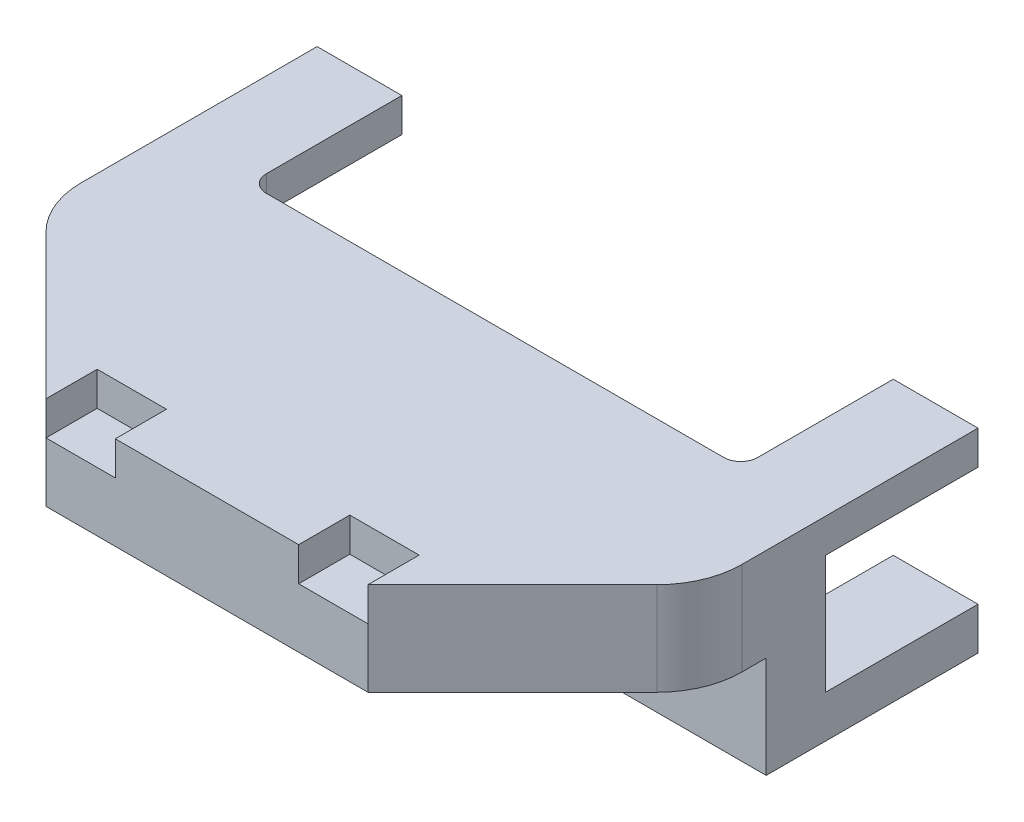
from build123d import *

# Parameters (mm, degrees)
SKETCH1_W           = 39
SKETCH1_H           = 11.5
BOSS_EXTRUDE1_DEPTH = 17
SKETCH2_W           = 5
SKETCH2_H           = 2.5
SKETCH2_H_2         = 2
BOSS_EXTRUDE2_DEPTH = 9
FILLET3_R           = 1
FILLET4_R           = 1
FILLET5_R           = 1
FILLET6_R           = 1
CHAMFER1_SIZE       = 10
CHAMFER2_SIZE       = 10
SKETCH4_W           = 4.09
SKETCH4_H           = 3.02
CUT_EXTRUDE1_DEPTH  = 2
SKETCH5_W           = 45.21307777
SKETCH5_H           = 21.662699148
CUT_EXTRUDE2_DEPTH  = 6
FILLET7_R           = 5
FILLET8_R           = 5


with BuildPart() as part:
    # Sketch1 → Boss-Extrude1 (new body)
    with BuildSketch(Plane.XY):
        with Locations((19.5, -5.75)):
            Rectangle(SKETCH1_W, SKETCH1_H)
    extrude(amount=BOSS_EXTRUDE1_DEPTH)

    # Sketch2 → Boss-Extrude2 (add)
    with BuildSketch(Plane(origin=(0, 0, 0), x_dir=(-1, 0, 0), z_dir=(0, 0, -1))):
        with Locations((-2.5, -10.25)):
            Rectangle(SKETCH2_W, SKETCH2_H)
        with Locations((-2.5, -1)):
            Rectangle(SKETCH2_W, SKETCH2_H_2)
        with Locations((-36.5, -10.25)):
            Rectangle(SKETCH2_W, SKETCH2_H)
        with Locations((-36.5, -1)):
            Rectangle(SKETCH2_W, SKETCH2_H_2)
    extrude(amount=BOSS_EXTRUDE2_DEPTH)

    # Fillet3
    fillet3_edges = [part.edges().sort_by_distance(p)[0] for p in [
        (34, -1, 0),
    ]]
    fillet(fillet3_edges, radius=FILLET3_R)

    # Fillet4
    fillet4_edges = [part.edges().sort_by_distance(p)[0] for p in [
        (5, -1, 0),
    ]]
    fillet(fillet4_edges, radius=FILLET4_R)

    # Fillet5
    fillet5_edges = [part.edges().sort_by_distance(p)[0] for p in [
        (34, -10.25, 0),
    ]]
    fillet(fillet5_edges, radius=FILLET5_R)

    # Fillet6
    fillet6_edges = [part.edges().sort_by_distance(p)[0] for p in [
        (5, -10.25, 0),
    ]]
    fillet(fillet6_edges, radius=FILLET6_R)

    # Chamfer1
    chamfer1_edges = [part.edges().sort_by_distance(p)[0] for p in [
        (39, -5.75, 17),
    ]]
    chamfer(chamfer1_edges, length=CHAMFER1_SIZE)

    # Chamfer2
    chamfer2_edges = [part.edges().sort_by_distance(p)[0] for p in [
        (0, -5.75, 17),
    ]]
    chamfer(chamfer2_edges, length=CHAMFER2_SIZE)

    # Sketch4 → Cut-Extrude1 (cut)
    with BuildSketch(Plane(origin=(0, 0, 0), x_dir=(1, 0, 0), z_dir=(0, 1, 0))):
        with Locations((26.955, -15.49)):
            Rectangle(SKETCH4_W, SKETCH4_H)
        with Locations((12.045, -15.49)):
            Rectangle(SKETCH4_W, SKETCH4_H)
    extrude(amount=-CUT_EXTRUDE1_DEPTH, mode=Mode.SUBTRACT)

    # Sketch5 → Cut-Extrude2 (cut)
    with BuildSketch(Plane.XZ.offset(11.5)):
        with Locations((22.606538885, 14.331349574)):
            Rectangle(SKETCH5_W, SKETCH5_H)
    extrude(amount=-CUT_EXTRUDE2_DEPTH, mode=Mode.SUBTRACT)

    # Fillet7
    fillet7_edges = [part.edges().sort_by_distance(p)[0] for p in [
        (0, -2.75, 7),
    ]]
    fillet(fillet7_edges, radius=FILLET7_R)

    # Fillet8
    fillet8_edges = [part.edges().sort_by_distance(p)[0] for p in [
        (39, -2.75, 7),
    ]]
    fillet(fillet8_edges, radius=FILLET8_R)


solid = part.part
